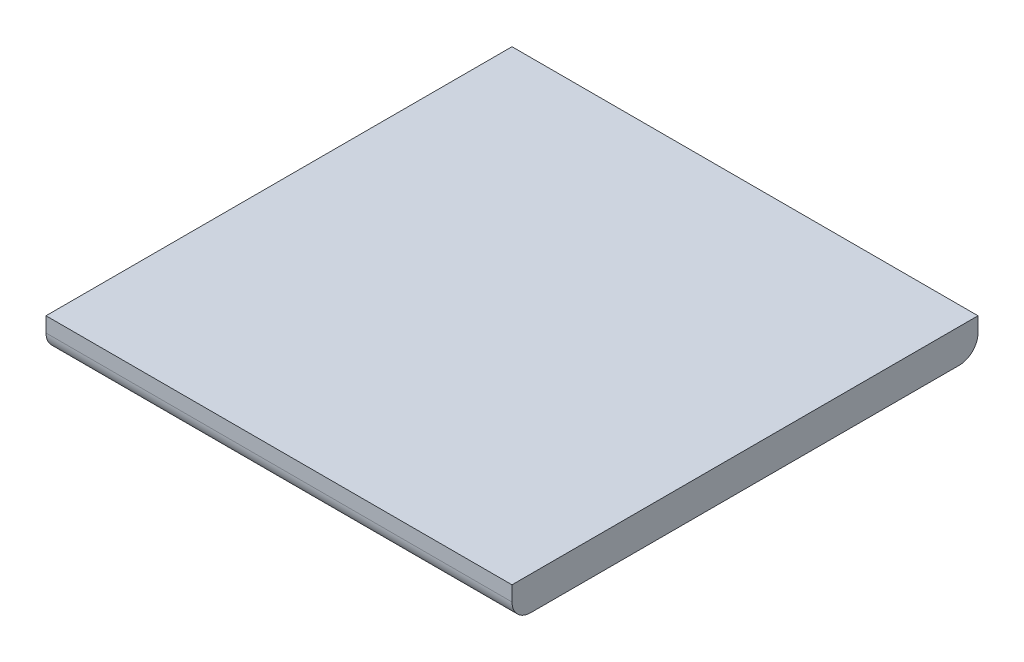
from build123d import *

# Parameters (mm, degrees)
SKETCH_1_W      = 250
SKETCH_1_H      = 250
EXTRUDE_1_DEPTH = 18
FILLET_1_R      = 10


with BuildPart() as part:
    # 草图1 → 凸台-拉伸1 (new body)
    with BuildSketch(Plane(origin=(0, 0, 0), x_dir=(1, 0, 0), z_dir=(0, 1, 0))):
        Rectangle(SKETCH_1_W, SKETCH_1_H)
    extrude(amount=EXTRUDE_1_DEPTH)

    # 圆角1
    fillet_1_edges = [part.edges().sort_by_distance(p)[0] for p in [
        (0, 0, -125),
        (0, 0, 125),
    ]]
    fillet(fillet_1_edges, radius=FILLET_1_R)


solid = part.part
